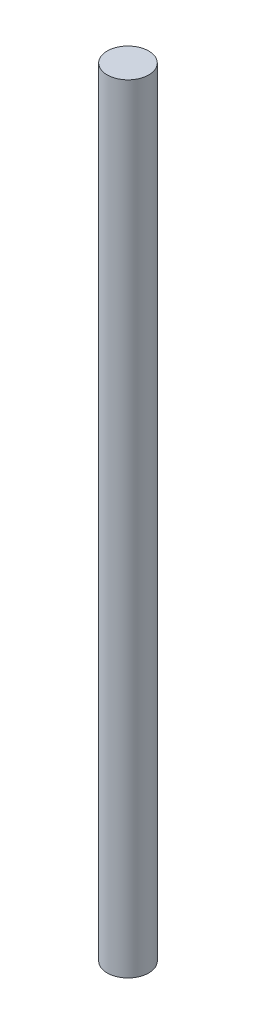
from build123d import *

# Parameters (mm, degrees)
SKETCH1_R  = 4
BASE_DEPTH = 150


with BuildPart() as part:
    # Sketch1 → Base (new body)
    with BuildSketch(Plane(origin=(0, 0, 0), x_dir=(1, 0, 0), z_dir=(0, 1, 0))):
        with Locations(Location((0, 0, 0), (0, 0, 270))):
            Circle(SKETCH1_R)
    extrude(amount=BASE_DEPTH)


solid = part.part
